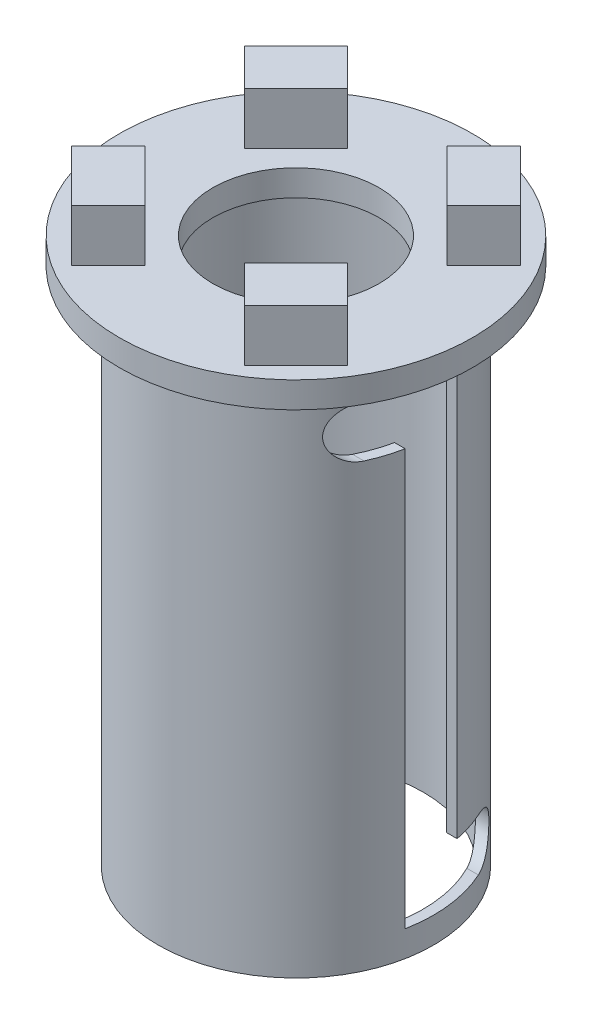
from build123d import *

# Parameters (mm, degrees)
SKETCH2_R           = 13.25
SKETCH2_R_2         = 12.25
BOSS_EXTRUDE1_DEPTH = 50
SKETCH4_W           = 5
SKETCH4_H           = 45
CUT_EXTRUDE2_DEPTH  = 5
SKETCH6_R           = 17
SKETCH6_R_2         = 8
BOSS_EXTRUDE3_DEPTH = 2.5
BOSS_EXTRUDE4_DEPTH = 5
SCALE1_SCALE        = 0.8


with BuildPart() as part:
    # Sketch2 → Boss-Extrude1 (new body)
    with BuildSketch(Plane(origin=(0, 0, 0), x_dir=(1, 0, 0), z_dir=(0, 1, 0))):
        with Locations(Location((0, 0, 0), (0, 0, 270))):
            Circle(SKETCH2_R)
        with Locations(Location((0, 0, 0), (0, 0, 270))):
            Circle(SKETCH2_R_2, mode=Mode.SUBTRACT)
    extrude(amount=BOSS_EXTRUDE1_DEPTH)

    # Sketch4 → Cut-Extrude2 (cut)
    with BuildSketch(Plane(origin=(13.25, 0, 0), x_dir=(0, 0, -1), z_dir=(1, 0, 0))):
        with BuildLine():
            ThreePointArc((-3, 45), (-3.732233047, 46.767766953), (-5.5, 47.5))
            Line((-5.5, 47.5), (-5.5, 42.5))
            ThreePointArc((-5.5, 42.5), (-3.732233047, 43.232233047), (-3, 45))
        make_face()
        with BuildLine():
            Line((-5.5, 42.5), (-5.5, 47.5))
            ThreePointArc((-5.5, 47.5), (-8, 45), (-5.5, 42.5))
        make_face()
        with Locations((0, 25)):
            Rectangle(SKETCH4_W, SKETCH4_H)
        with BuildLine():
            ThreePointArc((8, 5), (7.267766953, 6.767766953), (5.5, 7.5))
            Line((5.5, 7.5), (5.5, 2.5))
            ThreePointArc((5.5, 2.5), (7.267766953, 3.232233047), (8, 5))
        make_face()
        with BuildLine():
            Line((5.5, 2.5), (5.5, 7.5))
            ThreePointArc((5.5, 7.5), (3, 5), (5.5, 2.5))
        make_face()
        with BuildLine():
            Line((5.5, 7.5), (2.5, 7.5))
            Line((2.5, 7.5), (2.5, 2.5))
            Line((2.5, 2.5), (5.5, 2.5))
            ThreePointArc((5.5, 2.5), (3, 5), (5.5, 7.5))
        make_face()
        with BuildLine():
            Line((-2.5, 42.5), (-2.5, 47.5))
            Line((-2.5, 47.5), (-5.5, 47.5))
            ThreePointArc((-5.5, 47.5), (-3.732233047, 46.767766953), (-3, 45))
            ThreePointArc((-3, 45), (-3.732233047, 43.232233047), (-5.5, 42.5))
            Line((-5.5, 42.5), (-2.5, 42.5))
        make_face()
    extrude(amount=-CUT_EXTRUDE2_DEPTH, mode=Mode.SUBTRACT)

    # Sketch6 → Boss-Extrude3 (add)
    with BuildSketch(Plane(origin=(0, 50, 0), x_dir=(1, 0, 0), z_dir=(0, 1, 0))):
        with Locations(Location((0, 0, 0), (0, 0, 270))):
            Circle(SKETCH6_R)
        with Locations(Location((0, 0, 0), (0, 0, 270))):
            Circle(SKETCH6_R_2, mode=Mode.SUBTRACT)
    extrude(amount=BOSS_EXTRUDE3_DEPTH)

    # Sketch7 → Boss-Extrude4 (add)
    with BuildSketch(Plane(origin=(0, 52.5, 0), x_dir=(1, 0, 0), z_dir=(0, 1, 0))):
        with BuildLine():
            ThreePointArc((9.369164851, -9.369164851), (8.037023703, -10.534170589), (6.561511052, -11.51125852))
            Line((6.561511052, -11.51125852), (8.329278005, -13.279025473))
            Line((8.329278005, -13.279025473), (13.279025473, -8.329278005))
            Line((13.279025473, -8.329278005), (11.51125852, -6.561511052))
            ThreePointArc((11.51125852, -6.561511052), (10.534170589, -8.037023703), (9.369164851, -9.369164851))
        make_face()
        with BuildLine():
            ThreePointArc((-6.561511052, -11.51125852), (-8.037023703, -10.534170589), (-9.369164851, -9.369164851))
            ThreePointArc((-9.369164851, -9.369164851), (-10.534170589, -8.037023703), (-11.51125852, -6.561511052))
            Line((-11.51125852, -6.561511052), (-13.279025473, -8.329278005))
            Line((-13.279025473, -8.329278005), (-8.329278005, -13.279025473))
            Line((-8.329278005, -13.279025473), (-6.561511052, -11.51125852))
        make_face()
        with BuildLine():
            Line((-13.279025473, 8.329278005), (-11.51125852, 6.561511052))
            ThreePointArc((-11.51125852, 6.561511052), (-10.534170589, 8.037023703), (-9.369164851, 9.369164851))
            ThreePointArc((-9.369164851, 9.369164851), (-8.037023703, 10.534170589), (-6.561511052, 11.51125852))
            Line((-6.561511052, 11.51125852), (-8.329278005, 13.279025473))
            Line((-8.329278005, 13.279025473), (-13.279025473, 8.329278005))
        make_face()
        with BuildLine():
            ThreePointArc((-6.561511052, 11.51125852), (-8.037023703, 10.534170589), (-9.369164851, 9.369164851))
            Line((-9.369164851, 9.369164851), (-5.168070815, 9.369164851))
            Line((-5.168070815, 9.369164851), (-4.793744099, 9.743491567))
            Line((-4.793744099, 9.743491567), (-6.561511052, 11.51125852))
        make_face()
        with BuildLine():
            Line((-9.743491567, 4.793744099), (-9.369164851, 5.168070815))
            Line((-9.369164851, 5.168070815), (-9.369164851, 9.369164851))
            ThreePointArc((-9.369164851, 9.369164851), (-10.534170589, 8.037023703), (-11.51125852, 6.561511052))
            Line((-11.51125852, 6.561511052), (-9.743491567, 4.793744099))
        make_face()
        Polygon((-9.369164851, 9.369164851), (-9.369164851, 5.168070815), (-5.168070815, 9.369164851), align=None)
        with BuildLine():
            Line((-5.168070815, -9.369164851), (-9.369164851, -9.369164851))
            ThreePointArc((-9.369164851, -9.369164851), (-8.037023703, -10.534170589), (-6.561511052, -11.51125852))
            Line((-6.561511052, -11.51125852), (-4.793744099, -9.743491567))
            Line((-4.793744099, -9.743491567), (-5.168070815, -9.369164851))
        make_face()
        Polygon((-9.369164851, -5.168070815), (-9.369164851, -9.369164851), (-5.168070815, -9.369164851), align=None)
        with BuildLine():
            ThreePointArc((-11.51125852, -6.561511052), (-10.534170589, -8.037023703), (-9.369164851, -9.369164851))
            Line((-9.369164851, -9.369164851), (-9.369164851, -5.168070815))
            Line((-9.369164851, -5.168070815), (-9.743491567, -4.793744099))
            Line((-9.743491567, -4.793744099), (-11.51125852, -6.561511052))
        make_face()
        with BuildLine():
            Line((9.369164851, -5.168070815), (9.369164851, -9.369164851))
            ThreePointArc((9.369164851, -9.369164851), (10.534170589, -8.037023703), (11.51125852, -6.561511052))
            Line((11.51125852, -6.561511052), (9.743491567, -4.793744099))
            Line((9.743491567, -4.793744099), (9.369164851, -5.168070815))
        make_face()
        Polygon((9.369164851, -5.168070815), (5.168070815, -9.369164851), (9.369164851, -9.369164851), align=None)
        with BuildLine():
            Line((9.369164851, -9.369164851), (5.168070815, -9.369164851))
            Line((5.168070815, -9.369164851), (4.793744099, -9.743491567))
            Line((4.793744099, -9.743491567), (6.561511052, -11.51125852))
            ThreePointArc((6.561511052, -11.51125852), (8.037023703, -10.534170589), (9.369164851, -9.369164851))
        make_face()
        with BuildLine():
            ThreePointArc((6.561511052, 11.51125852), (8.037023703, 10.534170589), (9.369164851, 9.369164851))
            ThreePointArc((9.369164851, 9.369164851), (10.534170589, 8.037023703), (11.51125852, 6.561511052))
            Line((11.51125852, 6.561511052), (13.279025473, 8.329278005))
            Line((13.279025473, 8.329278005), (8.329278005, 13.279025473))
            Line((8.329278005, 13.279025473), (6.561511052, 11.51125852))
        make_face()
        with BuildLine():
            Line((4.793744099, 9.743491567), (5.168070815, 9.369164851))
            Line((5.168070815, 9.369164851), (9.369164851, 9.369164851))
            ThreePointArc((9.369164851, 9.369164851), (8.037023703, 10.534170589), (6.561511052, 11.51125852))
            Line((6.561511052, 11.51125852), (4.793744099, 9.743491567))
        make_face()
        Polygon((5.168070815, 9.369164851), (9.369164851, 5.168070815), (9.369164851, 9.369164851), align=None)
        with BuildLine():
            Line((9.369164851, 9.369164851), (9.369164851, 5.168070815))
            Line((9.369164851, 5.168070815), (9.743491567, 4.793744099))
            Line((9.743491567, 4.793744099), (11.51125852, 6.561511052))
            ThreePointArc((11.51125852, 6.561511052), (10.534170589, 8.037023703), (9.369164851, 9.369164851))
        make_face()
    extrude(amount=BOSS_EXTRUDE4_DEPTH)


with BuildPart() as part_1:
    # Scale1: scaled about (-0.56553808, 35.88383974, 2.07e-07)
    add(part.part.scale(SCALE1_SCALE).moved(Location((-0.113107616, 7.176767948, 4.1e-08))))


solid = part_1.part
